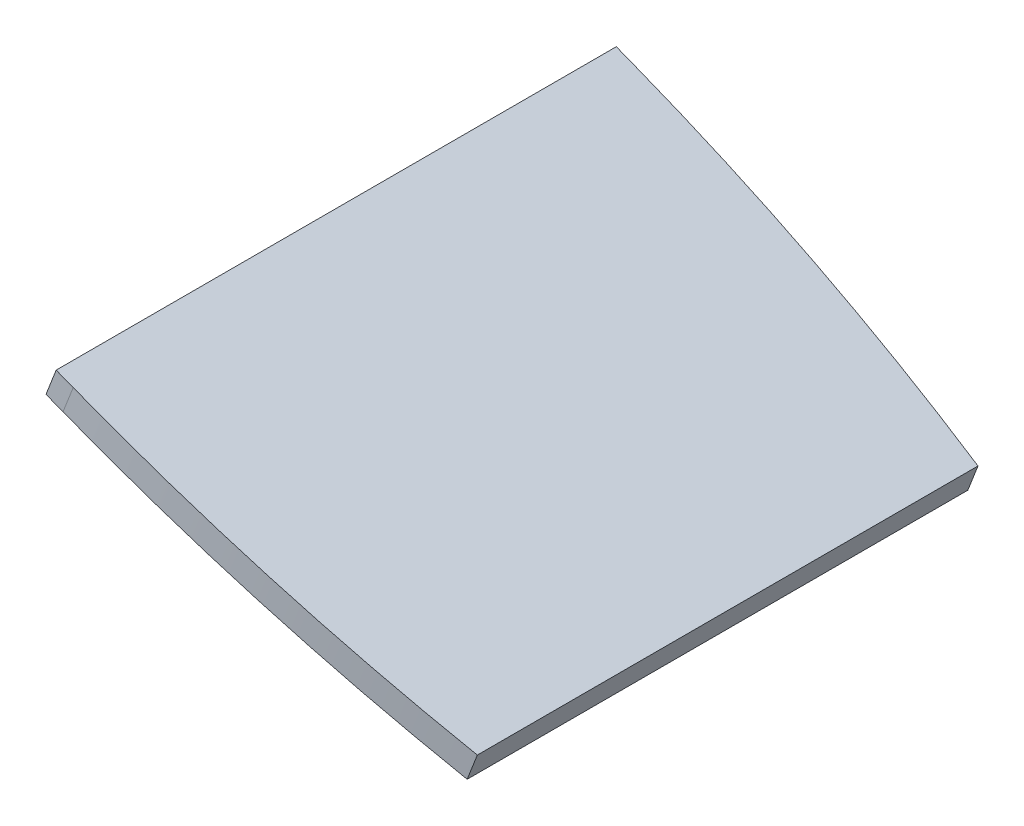
from build123d import *

# Parameters (mm, degrees)
BOSS_EXTRUDE1_DEPTH = 2.54


with BuildPart() as part:
    # Sketch2 → Boss-Extrude1 (new body)
    with BuildSketch(Plane(origin=(-5.189482347, -13.318449337, 0), x_dir=(0.9317661243126444, -0.363059071754713, 0), z_dir=(0.363059071754713, 0.9317661243126444, 0))):
        with BuildLine():
            Line((-113.947768075, -6.662671444), (-115.603901094, -6.662671444))
            Line((-115.603901094, -6.662671444), (-115.603901094, -57.462671444))
            Line((-115.603901094, -57.462671444), (-113.947768075, -57.462671444))
            ThreePointArc((-113.947768075, -57.462671444), (-95.676035106, -56.787703126), (-77.503901094, -54.766477415))
            Line((-77.503901094, -54.766477415), (-77.503901094, -9.358865474))
            ThreePointArc((-77.503901094, -9.358865474), (-95.676035106, -7.337639762), (-113.947768075, -6.662671444))
        make_face()
    extrude(amount=BOSS_EXTRUDE1_DEPTH)


solid = part.part
